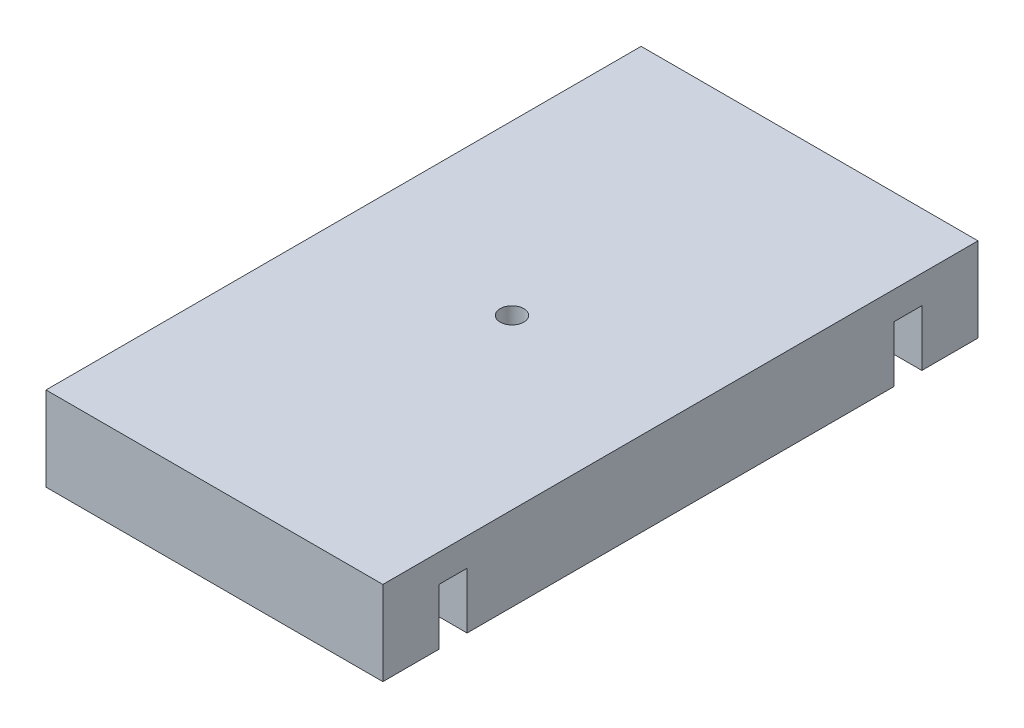
from build123d import *

# Parameters (mm, degrees)
SKETCH_1_W               = 60
SKETCH_1_H               = 106
EXTRUDE_1_DEPTH          = 15
CUT_EXTRUDE_1_DEPTH      = 10
CUT_EXTRUDE_2_DEPTH      = 63.721607122
CUT_EXTRUDE_2_DEPTH_BACK = 63.721607122
SKETCH_3_R               = 2.1


with BuildPart() as part:
    # 草图1 → 凸台-拉伸1 (new body)
    with BuildSketch(Plane(origin=(0, 0, 0), x_dir=(1, 0, 0), z_dir=(0, 1, 0))):
        Rectangle(SKETCH_1_W, SKETCH_1_H)
    extrude(amount=EXTRUDE_1_DEPTH)

    # 草图2 → 切除-拉伸1 (cut)
    with BuildSketch(Plane.XZ):
        Polygon((-32.957810335, 43), (38.640191428, 43), (38.640191428, 38), (-35.799000882, 38), align=None)
        Polygon((38.640191428, -38), (-35.799000882, -38), (-32.957810335, -43), (38.640191428, -43), align=None)
    extrude(amount=-CUT_EXTRUDE_1_DEPTH, mode=Mode.SUBTRACT)

    # 草图3 → 切除-拉伸2 (cut, two sides: drawn at the far end of the back side and taken through both)
    with BuildSketch(Plane(origin=(0, 15, 0), x_dir=(1, 0, 0), z_dir=(0, 1, 0)).offset(-CUT_EXTRUDE_2_DEPTH_BACK)):
        with Locations(Location((0, 0, 0), (0, 0, 270))):
            Circle(SKETCH_3_R)
    extrude(amount=CUT_EXTRUDE_2_DEPTH + CUT_EXTRUDE_2_DEPTH_BACK, mode=Mode.SUBTRACT)


solid = part.part
